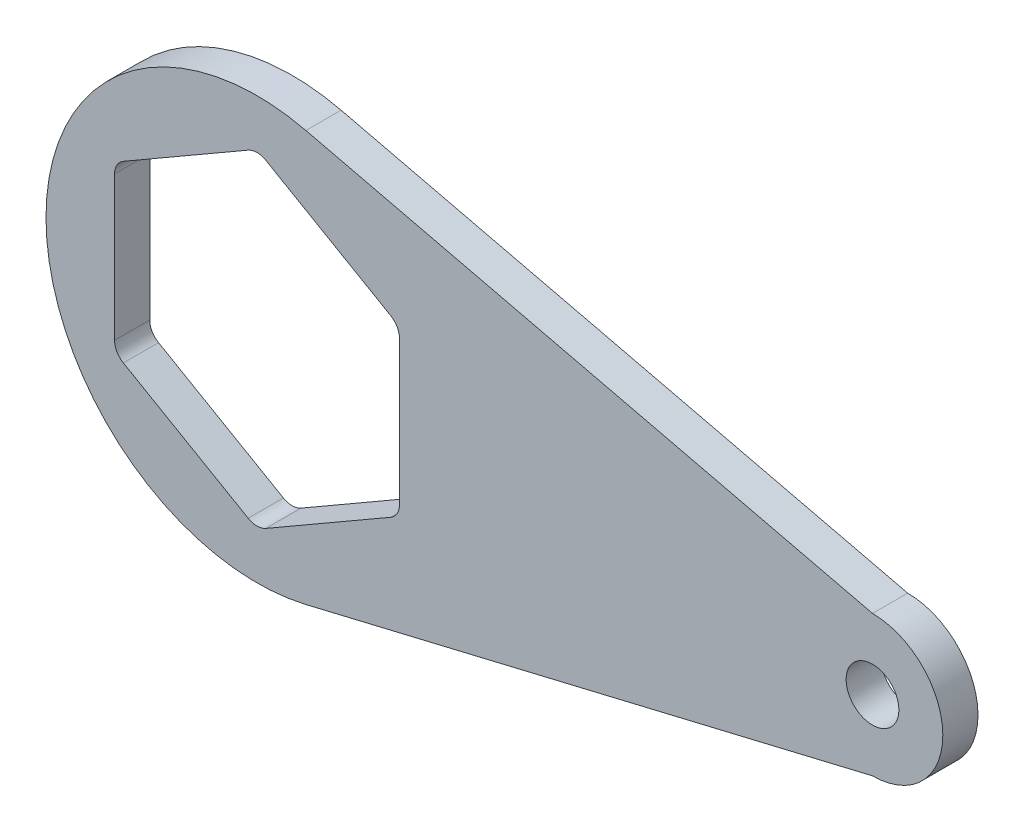
from build123d import *

# Parameters (mm, degrees)
SKETCH1_R           = 7.5
BOSS_EXTRUDE1_DEPTH = 10
FILLET1_R           = 5


with BuildPart() as part:
    # Sketch1 → Boss-Extrude1 (new body)
    with BuildSketch(Plane.XY):
        with BuildLine():
            Line((175, 20), (13.900856021, 58.367509814))
            ThreePointArc((13.900856021, 58.367509814), (-60, 0), (13.900856021, -58.367509814))
            Line((13.900856021, -58.367509814), (175, -20))
            ThreePointArc((175, -20), (195, 0), (175, 20))
        make_face()
        with Locations((175, 0)):
            Circle(SKETCH1_R, mode=Mode.SUBTRACT)
        Polygon((40.5, 23.382685902), (0, 46.765371804), (-40.5, 23.382685902), (-40.5, -23.382685902), (0, -46.765371804), (40.5, -23.382685902), align=None, mode=Mode.SUBTRACT)
    extrude(amount=BOSS_EXTRUDE1_DEPTH)

    # Fillet1
    fillet1_edges = [part.edges().sort_by_distance(p)[0] for p in [
        (0, -46.765371804, 5),
        (40.5, -23.382685902, 5),
        (40.5, 23.382685902, 5),
        (0, 46.765371804, 5),
        (-40.5, 23.382685902, 5),
        (-40.5, -23.382685902, 5),
    ]]
    fillet(fillet1_edges, radius=FILLET1_R)


solid = part.part
